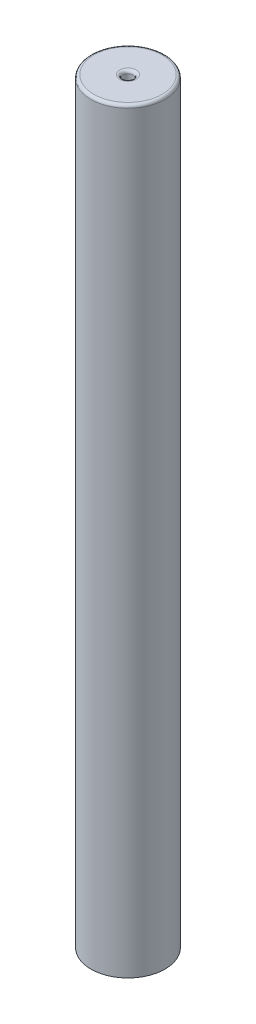
from build123d import *

# Parameters (mm, degrees)
SKETCH1_R           = 25
BOSS_EXTRUDE1_DEPTH = 510
SKETCH2_R           = 3.5
CUT_EXTRUDE1_DEPTH  = 30
FILLET1_R           = 2


with BuildPart() as part:
    # Sketch1 → Boss-Extrude1 (new body)
    with BuildSketch(Plane(origin=(0, 0, 0), x_dir=(1, 0, 0), z_dir=(0, 1, 0))):
        with Locations(Location((0, 0, 0), (0, 0, 270))):
            Circle(SKETCH1_R)
    extrude(amount=BOSS_EXTRUDE1_DEPTH)

    # Sketch2 → Cut-Extrude1 (cut)
    with BuildSketch(Plane(origin=(0, 510, 0), x_dir=(1, 0, 0), z_dir=(0, 1, 0))):
        with Locations(Location((0, 0, 0), (0, 0, 270))):
            Circle(SKETCH2_R)
    extrude(amount=-CUT_EXTRUDE1_DEPTH, mode=Mode.SUBTRACT)

    # Fillet1
    fillet1_edges = [part.edges().sort_by_distance(p)[0] for p in [
        (0, 510, -25),
        (0, 510, -3.5),
    ]]
    fillet(fillet1_edges, radius=FILLET1_R)


solid = part.part
